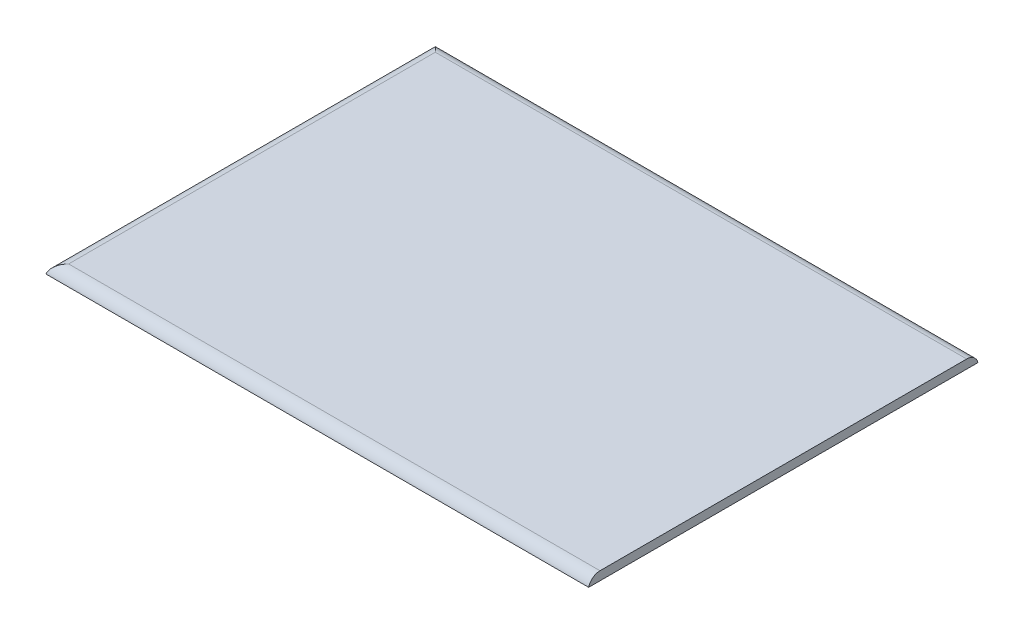
from build123d import *

# Parameters (mm, degrees)
SKETCH1_W           = 93
SKETCH1_H           = 66.8
BOSS_EXTRUDE1_DEPTH = 1.25
FILLET1_R           = 2
SKETCH2_W           = 93
SKETCH2_H           = 66.8
CUT_EXTRUDE1_DEPTH  = 1
SKETCH3_R           = 1
CUT_EXTRUDE2_DEPTH  = 0.75
SKETCH4_R           = 1.45
BOSS_EXTRUDE2_DEPTH = 5
SKETCH5_R           = 2.5
BOSS_EXTRUDE3_DEPTH = 1.8


with BuildPart() as part:
    # Sketch1 → Boss-Extrude1 (new, symmetric)
    with BuildSketch(Plane(origin=(0, 0, 0), x_dir=(1, 0, 0), z_dir=(0, 1, 0))):
        Rectangle(SKETCH1_W, SKETCH1_H)
    extrude(amount=BOSS_EXTRUDE1_DEPTH, both=True)

    # Fillet1
    fillet1_edges = [part.edges().sort_by_distance(p)[0] for p in [
        (0, 1.25, -33.4),
        (-46.5, 1.25, 0),
        (0, 1.25, 33.4),
    ]]
    fillet(fillet1_edges, radius=FILLET1_R)

    # Sketch2 → Cut-Extrude1 (cut)
    with BuildSketch(Plane.XZ.offset(1.25)):
        Rectangle(SKETCH2_W, SKETCH2_H)
    extrude(amount=-CUT_EXTRUDE1_DEPTH, mode=Mode.SUBTRACT)

    # Sketch3 → Cut-Extrude2 (cut)
    with BuildSketch(Plane.XZ.offset(0.25)):
        with Locations(Location((-43.5, 30.4, 0), (0, 0, 270))):
            Circle(SKETCH3_R)
        with Locations(Location((43.5, 30.4, 0), (0, 0, 270))):
            Circle(SKETCH3_R)
        with Locations(Location((43.5, -30.4, 0), (0, 0, 270))):
            Circle(SKETCH3_R)
        with Locations(Location((-43.5, -30.4, 0), (0, 0, 270))):
            Circle(SKETCH3_R)
    extrude(amount=-CUT_EXTRUDE2_DEPTH, mode=Mode.SUBTRACT)

    # Sketch4 → Boss-Extrude2 (add)
    with BuildSketch(Plane.XZ.offset(0.25)):
        with Locations(Location((-37.55, 26.486491673, 0), (0, 0, 270))):
            Circle(SKETCH4_R)
        with Locations(Location((17.55, 26.486491673, 0), (0, 0, 270))):
            Circle(SKETCH4_R)
        with Locations(Location((17.55, -19.613508327, 0), (0, 0, 270))):
            Circle(SKETCH4_R)
        with Locations(Location((-37.55, -19.613508327, 0), (0, 0, 270))):
            Circle(SKETCH4_R)
    extrude(amount=BOSS_EXTRUDE2_DEPTH)

    # Sketch5 → Boss-Extrude3 (add)
    with BuildSketch(Plane.XZ.offset(0.25)):
        with Locations(Location((-37.55, 26.486491673, 0), (0, 0, 270))):
            Circle(SKETCH5_R)
        with Locations(Location((17.55, 26.486491673, 0), (0, 0, 270))):
            Circle(SKETCH5_R)
        with Locations(Location((17.55, -19.613508327, 0), (0, 0, 270))):
            Circle(SKETCH5_R)
        with Locations(Location((-37.55, -19.613508327, 0), (0, 0, 270))):
            Circle(SKETCH5_R)
    extrude(amount=BOSS_EXTRUDE3_DEPTH)


solid = part.part
